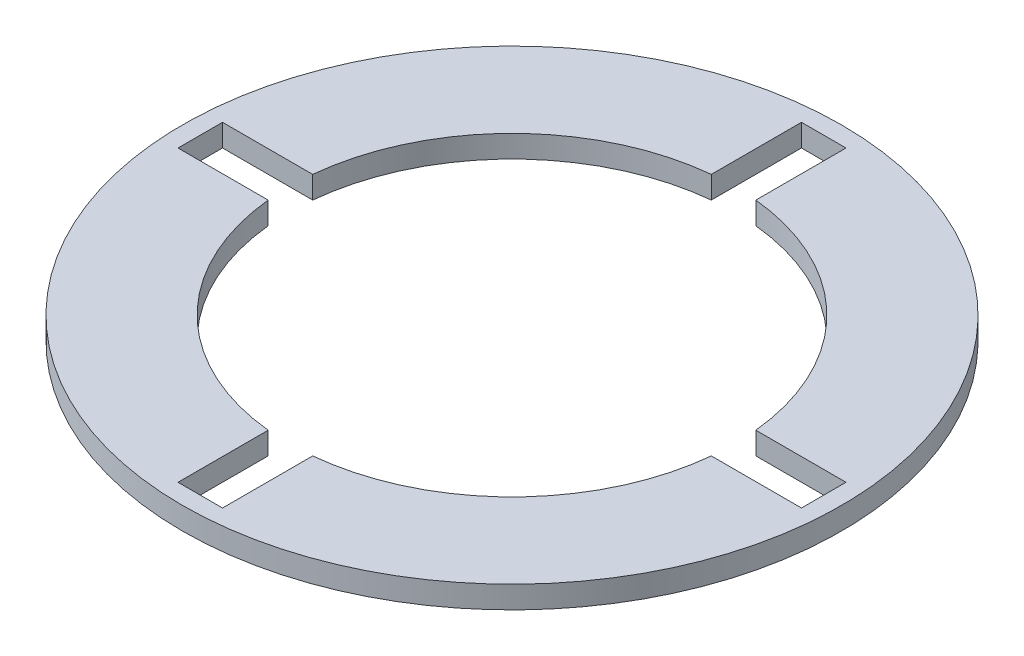
from build123d import *

# Parameters (mm, degrees)
SKETCH1_R           = 46.99
BOSS_EXTRUDE1_DEPTH = 3.175
SKETCH2_R           = 14.351
CUT_EXTRUDE1_DEPTH  = 3.175
CUT_EXTRUDE2_DEPTH  = 7.62
SKETCH6_R           = 31.75
CUT_EXTRUDE3_DEPTH  = 5.08


with BuildPart() as part:
    # Sketch1 → Boss-Extrude1 (new body)
    with BuildSketch(Plane(origin=(0, 0, 0), x_dir=(1, 0, 0), z_dir=(0, 1, 0))):
        with Locations(Location((0, 0, 0), (0, 0, 270))):
            Circle(SKETCH1_R)
    extrude(amount=BOSS_EXTRUDE1_DEPTH)

    # Sketch2 → Cut-Extrude1 (cut)
    with BuildSketch(Plane(origin=(0, 3.175, 0), x_dir=(1, 0, 0), z_dir=(0, 1, 0))):
        with Locations(Location((0, 0, 0), (0, 0, 270))):
            Circle(SKETCH2_R)
    extrude(amount=-CUT_EXTRUDE1_DEPTH, mode=Mode.SUBTRACT)

    # Sketch5 → Cut-Extrude2 (cut)
    with BuildSketch(Plane(origin=(0, 3.175, 0), x_dir=(1, 0, 0), z_dir=(0, 1, 0))):
        with BuildLine():
            Line((3.175, 13.995376951), (3.175, 44.45))
            Line((3.175, 44.45), (-3.175, 44.45))
            Line((-3.175, 44.45), (-3.175, 13.995376951))
            ThreePointArc((-3.175, 13.995376951), (0, 14.351), (3.175, 13.995376951))
        make_face()
        with BuildLine():
            Line((3.175, -44.45), (3.175, -13.995376951))
            ThreePointArc((3.175, -13.995376951), (0, -14.351), (-3.175, -13.995376951))
            Line((-3.175, -13.995376951), (-3.175, -44.45))
            Line((-3.175, -44.45), (3.175, -44.45))
        make_face()
        with BuildLine():
            ThreePointArc((-13.995376951, -3.175), (-14.351, 0), (-13.995376951, 3.175))
            Line((-13.995376951, 3.175), (-44.45, 3.175))
            Line((-44.45, 3.175), (-44.45, -3.175))
            Line((-44.45, -3.175), (-13.995376951, -3.175))
        make_face()
        with BuildLine():
            Line((44.45, 3.175), (13.995376951, 3.175))
            ThreePointArc((13.995376951, 3.175), (14.261817129, 1.597427053), (14.351, 0))
            ThreePointArc((14.351, 0), (14.261817129, -1.597427053), (13.995376951, -3.175))
            Line((13.995376951, -3.175), (44.45, -3.175))
            Line((44.45, -3.175), (44.45, 3.175))
        make_face()
    extrude(amount=-CUT_EXTRUDE2_DEPTH, mode=Mode.SUBTRACT)

    # Sketch6 → Cut-Extrude3 (cut)
    with BuildSketch(Plane(origin=(0, 3.175, 0), x_dir=(1, 0, 0), z_dir=(0, 1, 0))):
        Circle(SKETCH6_R)
    extrude(amount=-CUT_EXTRUDE3_DEPTH, mode=Mode.SUBTRACT)


solid = part.part
